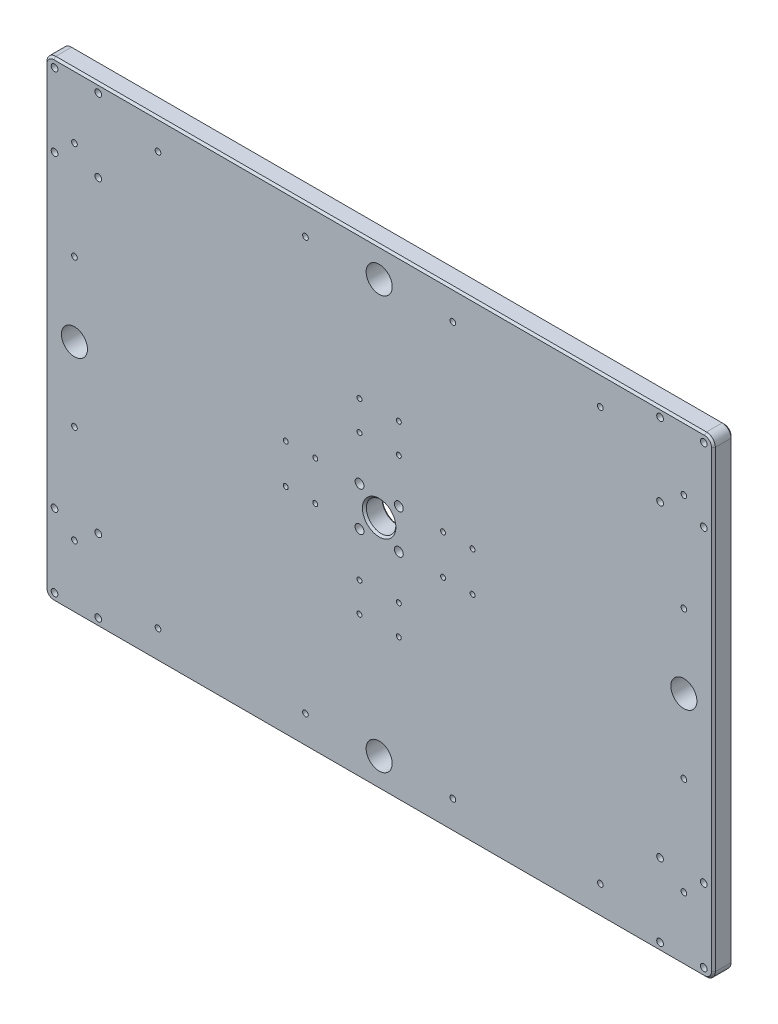
from build123d import *

# Parameters (mm, degrees)
SKETCH_1_W                = 680
SKETCH_1_H                = 480
EXTRUDE_1_DEPTH           = 20
FILLET_1_R                = 9
CHAMFER_3_SIZE            = 2
HOLE_WIZARD_M30_1_D       = 26.5
HOLE_WIZARD_M30_1_DEPTH   = 70.5
HOLE_WIZARD_M30_1_TIP     = 7.961403202
HOLE_WIZARD_1_D           = 9
HOLE_WIZARD_1_DEPTH       = 70.5
HOLE_WIZARD_1_CBORE_D     = 15
HOLE_WIZARD_1_CBORE_DEPTH = 9
HOLE_WIZARD_1_TIP         = 2.703872786
SKETCH_8_R                = 15
CUT_EXTRUDE_2_DEPTH       = 417.65333312
CHAMFER_5_SIZE            = 2
HOLE_WIZARD_M6_1_D        = 5
HOLE_WIZARD_M8_1_D        = 6.8
HOLE_WIZARD_2_D           = 6.6
HOLE_WIZARD_2_DEPTH       = 19.75
HOLE_WIZARD_2_CBORE_D     = 11
HOLE_WIZARD_2_CBORE_DEPTH = 6.8
HOLE_WIZARD_2_TIP         = 1.982840043


with BuildPart() as part:
    # 草图1 → 凸台-拉伸1 (new body)
    with BuildSketch(Plane.XY):
        Rectangle(SKETCH_1_W, SKETCH_1_H)
    extrude(amount=EXTRUDE_1_DEPTH)

    # 圆角1
    fillet_1_edges = [part.edges().sort_by_distance(p)[0] for p in [
        (340, -240, 10),
        (-340, -240, 10),
        (-340, 240, 10),
        (340, 240, 10),
    ]]
    fillet(fillet_1_edges, radius=FILLET_1_R)

    # 倒角3
    chamfer_3_edges = [part.edges().sort_by_distance(p)[0] for p in [
        (-340, 0, 0),
        (-340, 0, 20),
        (340, 0, 0),
        (0, -240, 0),
        (0, 240, 0),
        (-337.363961031, -237.363961031, 0),
        (337.363961031, -237.363961031, 0),
        (337.363961031, 237.363961031, 0),
        (-337.363961031, 237.363961031, 0),
        (0, 240, 20),
        (340, 0, 20),
        (0, -240, 20),
        (-337.363961031, -237.363961031, 20),
        (337.363961031, -237.363961031, 20),
        (337.363961031, 237.363961031, 20),
        (-337.363961031, 237.363961031, 20),
    ]]
    chamfer(chamfer_3_edges, length=CHAMFER_3_SIZE)

    # M30 螺纹孔1
    with Locations(Plane(origin=(0, 0, 0), x_dir=(-1, 0, 0), z_dir=(0, 0, -1))):
        with Locations((0, 210), (-310, 0), (0, -210), (310, 0)):
            Hole(HOLE_WIZARD_M30_1_D / 2, depth=HOLE_WIZARD_M30_1_DEPTH)
            with Locations((0, 0, -(HOLE_WIZARD_M30_1_DEPTH + HOLE_WIZARD_M30_1_TIP / 2))):  # 118° drill point
                Cone(0, HOLE_WIZARD_M30_1_D / 2, HOLE_WIZARD_M30_1_TIP, mode=Mode.SUBTRACT)

    # 打孔尺寸(%根据)内六角圆柱头螺钉的类型1
    with Locations(Plane(origin=(0, 0, 0), x_dir=(-1, 0, 0), z_dir=(0, 0, -1))):
        with Locations((20, -20), (-20, -20), (-20, 20), (20, 20)):
            CounterBoreHole(HOLE_WIZARD_1_D / 2, HOLE_WIZARD_1_CBORE_D / 2, HOLE_WIZARD_1_CBORE_DEPTH, depth=HOLE_WIZARD_1_DEPTH)
            with Locations((0, 0, -(HOLE_WIZARD_1_DEPTH + HOLE_WIZARD_1_TIP / 2))):  # 118° drill point
                Cone(0, HOLE_WIZARD_1_D / 2, HOLE_WIZARD_1_TIP, mode=Mode.SUBTRACT)

    # 草图8 → 切除-拉伸2 (cut, through all)
    with BuildSketch(Plane.XY.offset(20)):
        Circle(SKETCH_8_R)
    extrude(amount=-CUT_EXTRUDE_2_DEPTH, mode=Mode.SUBTRACT)

    # 倒角5
    chamfer_5_edges = [part.edges().sort_by_distance(p)[0] for p in [
        (-15, 0, 0),
        (-15, 0, 20),
    ]]
    chamfer(chamfer_5_edges, length=CHAMFER_5_SIZE)

    # M6 螺纹孔1 (through all)
    with Locations(Plane.XY.offset(20)):
        with Locations((65, -20), (20, 95), (20, 65), (-20, 65), (-20, 95), (20, -65), (20, -95), (-20, -95), (-20, -65), (-95, 20), (-65, 20), (-65, -20), (-95, -20), (65, 20), (95, 20), (95, -20)):
            Hole(HOLE_WIZARD_M6_1_D / 2)

    # M8 螺纹孔1 (through all)
    with Locations(Plane(origin=(0, 0, 0), x_dir=(-1, 0, 0), z_dir=(0, 0, -1))):
        with Locations((330.25, -231.25), (285.75, -231.25), (285.75, -156.75), (330.25, -156.75), (-285.75, -231.25), (-330.25, -231.25), (-330.25, -156.75), (-285.75, -156.75), (330.25, 156.75), (285.75, 156.75), (285.75, 231.25), (330.25, 231.25), (-285.75, 156.75), (-330.25, 156.75), (-330.25, 231.25), (-285.75, 231.25)):
            Hole(HOLE_WIZARD_M8_1_D / 2)

    # 打孔尺寸(%根据)内六角圆柱头螺钉的类型2
    with Locations(Plane(origin=(0, 0, 0), x_dir=(-1, 0, 0), z_dir=(0, 0, -1))):
        with Locations((225, -210), (75, -210), (-75, -210), (-225, -210), (225, 210), (75, 210), (-75, 210), (-225, 210), (310, -175), (310, 175), (-310, -175), (-310, 175), (-310, -75), (-310, 75), (310, -75), (310, 75)):
            CounterBoreHole(HOLE_WIZARD_2_D / 2, HOLE_WIZARD_2_CBORE_D / 2, HOLE_WIZARD_2_CBORE_DEPTH, depth=HOLE_WIZARD_2_DEPTH)
            with Locations((0, 0, -(HOLE_WIZARD_2_DEPTH + HOLE_WIZARD_2_TIP / 2))):  # 118° drill point
                Cone(0, HOLE_WIZARD_2_D / 2, HOLE_WIZARD_2_TIP, mode=Mode.SUBTRACT)


solid = part.part
